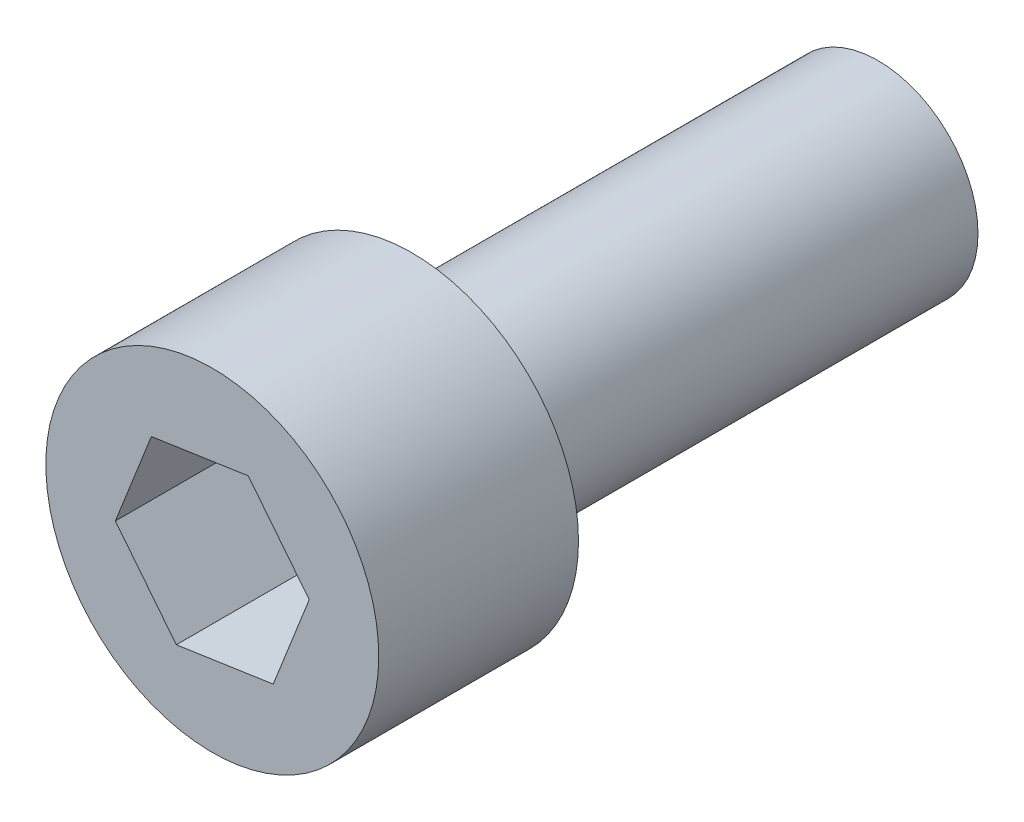
from build123d import *

# Parameters (mm, degrees)
SKETCH_1_R           = 3
EXTRUDE_1_DEPTH      = 15
EXTRUDE_2_DEPTH      = 5
EXTRUDE_2_DEPTH_BACK = 1
SKETCH_2_R           = 5


with BuildPart() as part:
    # 草图1 → 拉伸1 (new body)
    with BuildSketch(Plane.XY):
        Circle(SKETCH_1_R)
    extrude(amount=EXTRUDE_1_DEPTH)

    # 草图2 → 拉伸2 (add, two sides: drawn at the far end of the back side and taken through both)
    with BuildSketch(Plane.XY.offset(15).offset(-EXTRUDE_2_DEPTH_BACK)):
        Circle(SKETCH_2_R)
        Polygon((-1.830187787, 2.305076164), (-2.911348409, -0.432451036), (-1.081160622, -2.7375272), (1.830187787, -2.305076164), (2.911348409, 0.432451036), (1.081160622, 2.7375272), align=None, mode=Mode.SUBTRACT)
    extrude(amount=EXTRUDE_2_DEPTH + EXTRUDE_2_DEPTH_BACK)


solid = part.part
